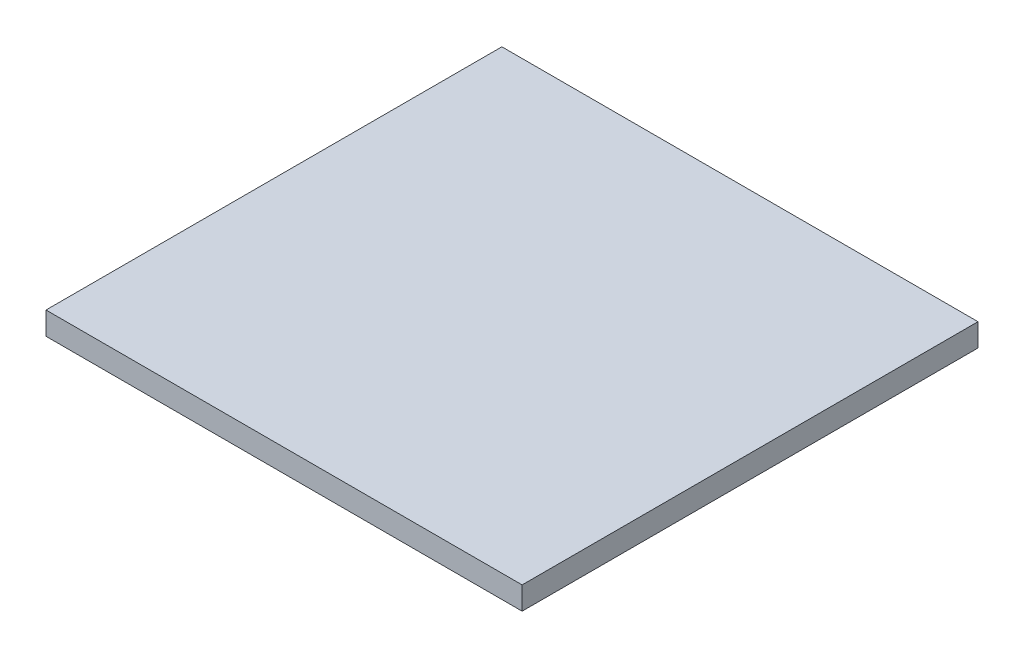
from build123d import *

# Parameters (mm, degrees)
CROQUIS1_W              = 376
CROQUIS1_H              = 360
SALIENTE_EXTRUIR1_DEPTH = 18


with BuildPart() as part:
    # Croquis1 → Saliente-Extruir1 (new body)
    with BuildSketch(Plane(origin=(0, 0, 0), x_dir=(1, 0, 0), z_dir=(0, 1, 0))):
        Rectangle(CROQUIS1_W, CROQUIS1_H)
    extrude(amount=SALIENTE_EXTRUIR1_DEPTH)


solid = part.part
